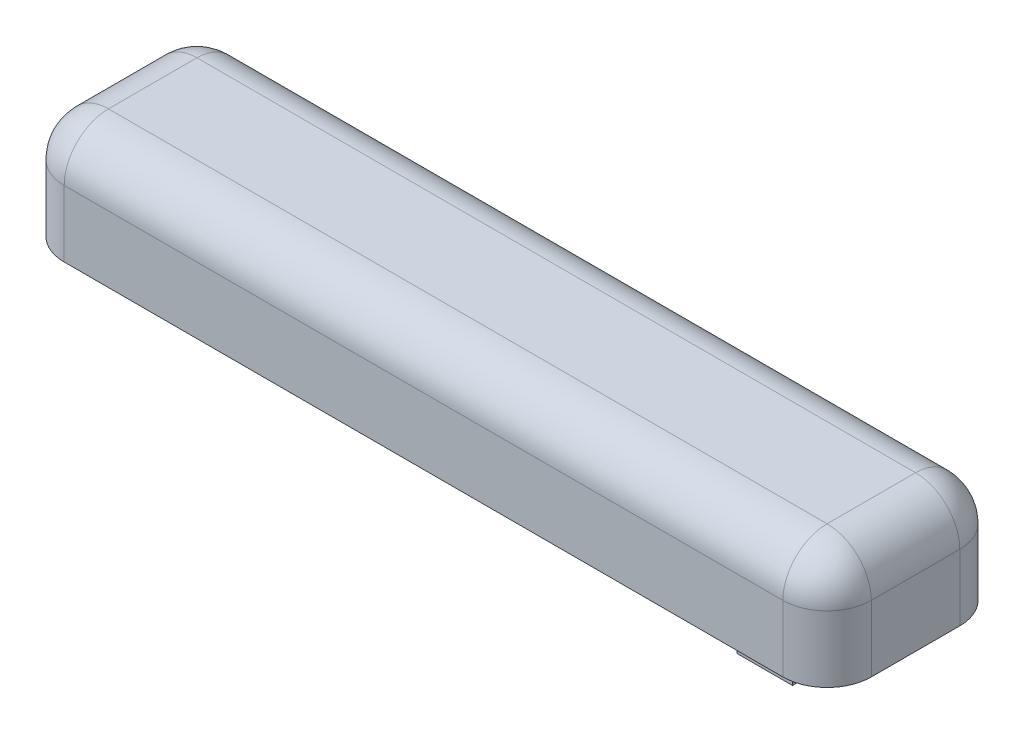
from build123d import *

# Parameters (mm, degrees)
CROQUIS1_W              = 365
CROQUIS1_H              = 80
SALIENTE_EXTRUIR1_DEPTH = 50
REDONDEO1_R             = 20
REDONDEO2_R             = 20
REDONDEO3_R             = 20
REDONDEO4_R             = 20
CROQUIS2_W              = 25
CROQUIS2_H              = 25
SALIENTE_EXTRUIR2_DEPTH = 27
CROQUIS3_W              = 19
CROQUIS3_H              = 19
CORTAR_EXTRUIR1_DEPTH   = 23


with BuildPart() as part:
    # Croquis1 → Saliente-Extruir1 (new body)
    with BuildSketch(Plane(origin=(0, 0, 0), x_dir=(1, 0, 0), z_dir=(0, 1, 0))):
        with Locations((-182.5, 40)):
            Rectangle(CROQUIS1_W, CROQUIS1_H)
    extrude(amount=SALIENTE_EXTRUIR1_DEPTH)

    # Redondeo1
    redondeo1_edges = [part.edges().sort_by_distance(p)[0] for p in [
        (-182.5, 50, -80),
    ]]
    fillet(redondeo1_edges, radius=REDONDEO1_R)

    # Redondeo2
    redondeo2_edges = [part.edges().sort_by_distance(p)[0] for p in [
        (-182.5, 50, 0),
    ]]
    fillet(redondeo2_edges, radius=REDONDEO2_R)

    # Redondeo3
    redondeo3_edges = [part.edges().sort_by_distance(p)[0] for p in [
        (0, 15, -80),
        (0, 44.142135624, -74.142135624),
        (0, 15, 0),
        (0, 50, -40),
        (0, 44.142135624, -5.857864376),
    ]]
    fillet(redondeo3_edges, radius=REDONDEO3_R)

    # Redondeo4
    redondeo4_edges = [part.edges().sort_by_distance(p)[0] for p in [
        (-365, 15, -80),
        (-365, 44.142135624, -74.142135624),
        (-365, 15, 0),
        (-365, 50, -40),
        (-365, 44.142135624, -5.857864376),
    ]]
    fillet(redondeo4_edges, radius=REDONDEO4_R)

    # Croquis2 → Saliente-Extruir2 (add)
    with BuildSketch(Plane.XZ):
        with Locations((-53.967193185, -38.316617584)):
            Rectangle(CROQUIS2_W, CROQUIS2_H)
    extrude(amount=SALIENTE_EXTRUIR2_DEPTH)

    # Croquis3 → Cortar-Extruir1 (cut)
    with BuildSketch(Plane.XZ.offset(27)):
        with Locations((-54, -38)):
            Rectangle(CROQUIS3_W, CROQUIS3_H)
    extrude(amount=-CORTAR_EXTRUIR1_DEPTH, mode=Mode.SUBTRACT)


solid = part.part
